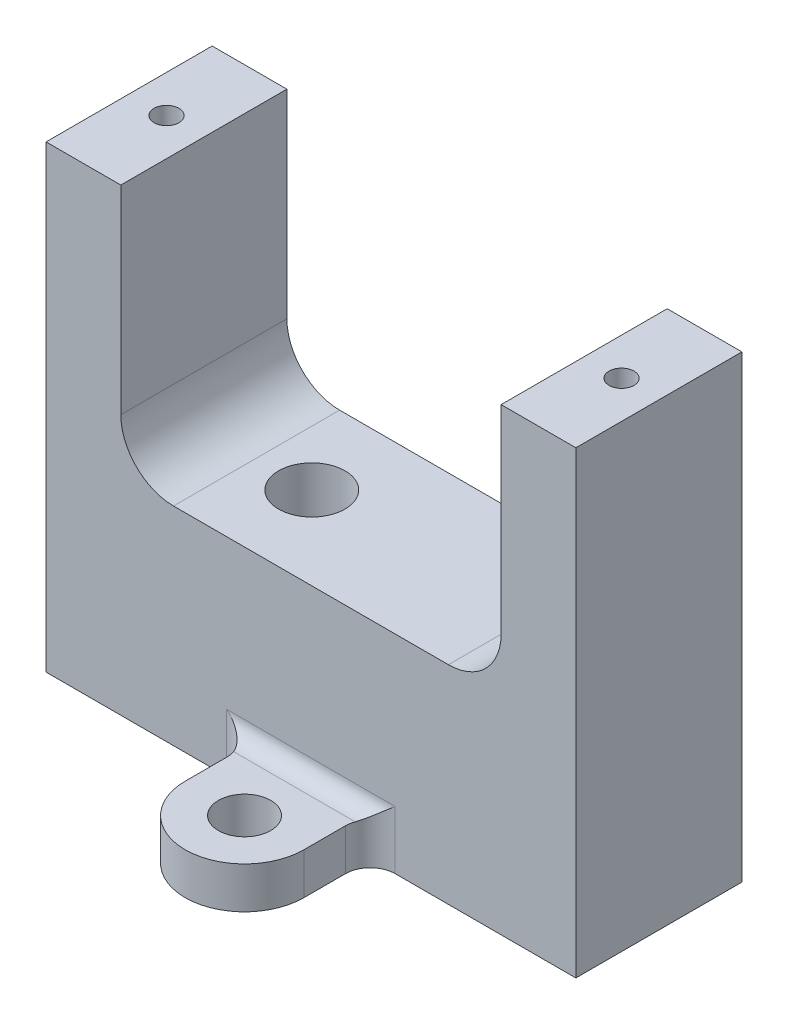
from build123d import *

# Parameters (mm, degrees)
SKETCH1_W                      = 4.5
SKETCH1_H                      = 10
BOSS_EXTRUDE1_DEPTH            = 15.15
BOSS_EXTRUDE1_2_DEPTH          = 15.15
F_1_5MM_DOWEL_HOLE1_AT_2_COUNT = 2
F_1_5MM_DOWEL_HOLE1_AT_2_PITCH = 27.4
SKETCH5_W                      = 31.9
SKETCH5_H                      = 10
SKETCH5_R                      = 2
BOSS_EXTRUDE2_DEPTH            = 12.5
FILLET1_R                      = 3.175
SKETCH6_R                      = 2
CUT_EXTRUDE1_DEPTH             = 15.4
SKETCH7_R                      = 1.575
BOSS_EXTRUDE3_DEPTH            = 2.5
FILLET3_R                      = 1.5
FILLET4_R                      = 1


with BuildPart() as part:
    # Sketch1 → Boss-Extrude1 (new body)
    with BuildSketch(Plane(origin=(0, 0, 0), x_dir=(1, 0, 0), z_dir=(0, 1, 0))):
        with Locations((-13.7, 0)):
            Rectangle(SKETCH1_W, SKETCH1_H)
    extrude(amount=-BOSS_EXTRUDE1_DEPTH)

    # Sketch4 → Ø1.5mm Dowel Hole1 (revolve, cut)
    with BuildSketch(Plane(origin=(-13.7, 0, 0), x_dir=(0, 0, 1), z_dir=(1, 0, 0))):
        Polygon((0, 0), (0, 12), (0.75, 11.549354536), (0.75, 0), align=None)
    f_1_5mm_dowel_hole1 = revolve(axis=Axis((-13.7, 6.35, 0), (0, -1, 0)), mode=Mode.SUBTRACT)



with BuildPart() as body_2:
    # Sketch1 → Boss-Extrude1 2 (new body)
    with BuildSketch(Plane(origin=(0, 0, 0), x_dir=(1, 0, 0), z_dir=(0, 1, 0))):
        with Locations((13.7, 0)):
            Rectangle(SKETCH1_W, SKETCH1_H)
    extrude(amount=-BOSS_EXTRUDE1_2_DEPTH)

    # Ø1.5mm Dowel Hole1 at 2: Ø1.5mm Dowel Hole1 ×2
    with Locations(*[(i * F_1_5MM_DOWEL_HOLE1_AT_2_PITCH, 0, 0) for i in range(1, F_1_5MM_DOWEL_HOLE1_AT_2_COUNT)]):
        add(f_1_5mm_dowel_hole1, mode=Mode.SUBTRACT)


with BuildPart() as part_1:
    add(part.part)

    add(body_2.part)  # Boss-Extrude2 merges body 2
    # Sketch5 → Boss-Extrude2 (add)
    with BuildSketch(Plane.XZ.offset(15.15)):
        Rectangle(SKETCH5_W, SKETCH5_H)
        with Locations(Location((-4.95, 0, 0), (0, 0, 270))):
            Circle(SKETCH5_R, mode=Mode.SUBTRACT)
    extrude(amount=BOSS_EXTRUDE2_DEPTH)

    # Fillet1
    fillet1_edges = [part_1.edges().sort_by_distance(p)[0] for p in [
        (-11.45, -15.15, 0),
        (11.45, -15.15, 0),
    ]]
    fillet(fillet1_edges, radius=FILLET1_R)

    # Sketch6 → Cut-Extrude1 (cut)
    with BuildSketch(Plane.ZY.offset(15.95)):
        with Locations((-1.2, -20.65)):
            Circle(SKETCH6_R)
    extrude(amount=-CUT_EXTRUDE1_DEPTH, mode=Mode.SUBTRACT)

    # Sketch7 → Boss-Extrude3 (add)
    # profile 1 of 2: a face of its own
    with BuildSketch(Plane.XZ.offset(27.65)):
        with BuildLine():
            Line((3.575, 9), (3.575, 5))
            Line((3.575, 5), (-3.575, 5))
            Line((-3.575, 5), (-3.575, 9))
            ThreePointArc((-3.575, 9), (0, 12.575), (3.575, 9))
        make_face()
        with Locations(Location((0, 9, 0), (0, 0, 270))):
            Circle(SKETCH7_R, mode=Mode.SUBTRACT)
    # profile 2 of 2: a face of its own
    with BuildSketch(Plane.XZ.offset(27.65)):
        with BuildLine():
            Line((3.575, -5), (-3.575, -5))
            Line((-3.575, -5), (-3.575, -9))
            ThreePointArc((-3.575, -9), (0, -12.575), (3.575, -9))
            Line((3.575, -9), (3.575, -5))
        make_face()
        with Locations(Location((0, -9, 0), (0, 0, 270))):
            Circle(SKETCH7_R, mode=Mode.SUBTRACT)
    extrude(amount=-BOSS_EXTRUDE3_DEPTH)

    # Fillet3
    fillet3_edges = [part_1.edges().sort_by_distance(p)[0] for p in [
        (3.575, -26.4, 5),
        (-3.575, -26.4, 5),
        (-3.575, -26.4, -5),
        (3.575, -26.4, -5),
    ]]
    fillet(fillet3_edges, radius=FILLET3_R)

    # Fillet4
    fillet4_edges = [part_1.edges().sort_by_distance(p)[0] for p in [
        (0, -25.15, 5),
        (0, -25.15, -5),
    ]]
    fillet(fillet4_edges, radius=FILLET4_R)


solid = part_1.part
